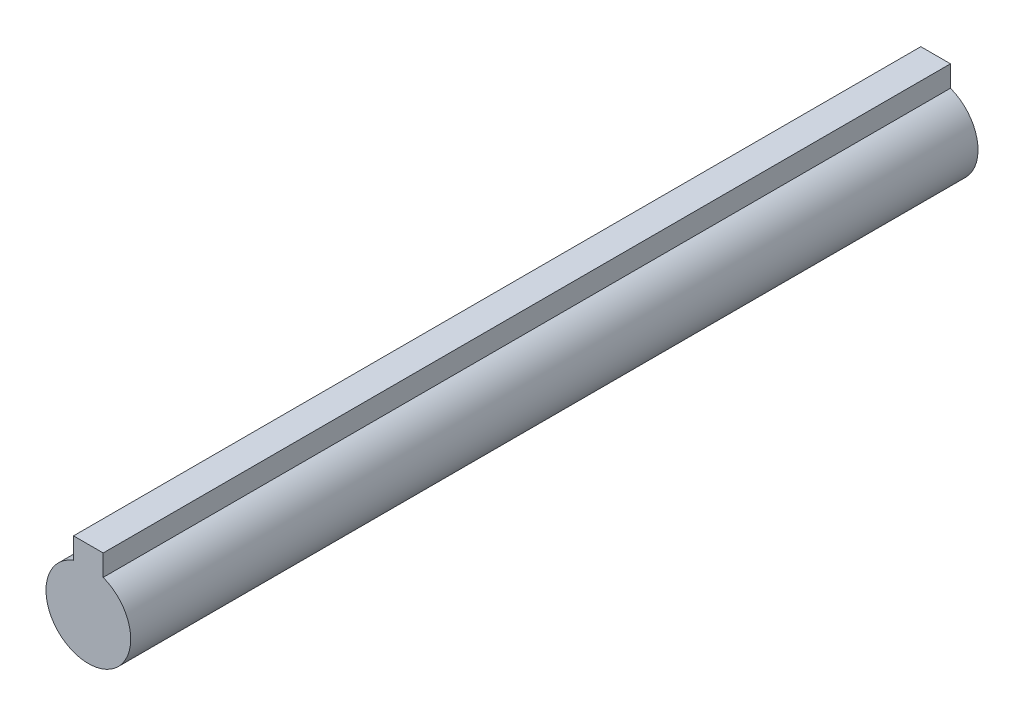
from build123d import *

# Parameters (mm, degrees)
SALIENTE_EXTRUIR1_DEPTH = 100


with BuildPart() as part:
    # Croquis1 → Saliente-Extruir1 (new, symmetric)
    with BuildSketch(Plane.XY):
        with BuildLine():
            Line((-3.5, 14.367496998), (3.5, 14.367496998))
            Line((3.5, 14.367496998), (3.5, 9.367496998))
            ThreePointArc((3.5, 9.367496998), (0, -10), (-3.5, 9.367496998))
            Line((-3.5, 9.367496998), (-3.5, 14.367496998))
        make_face()
    extrude(amount=SALIENTE_EXTRUIR1_DEPTH, both=True)


solid = part.part
